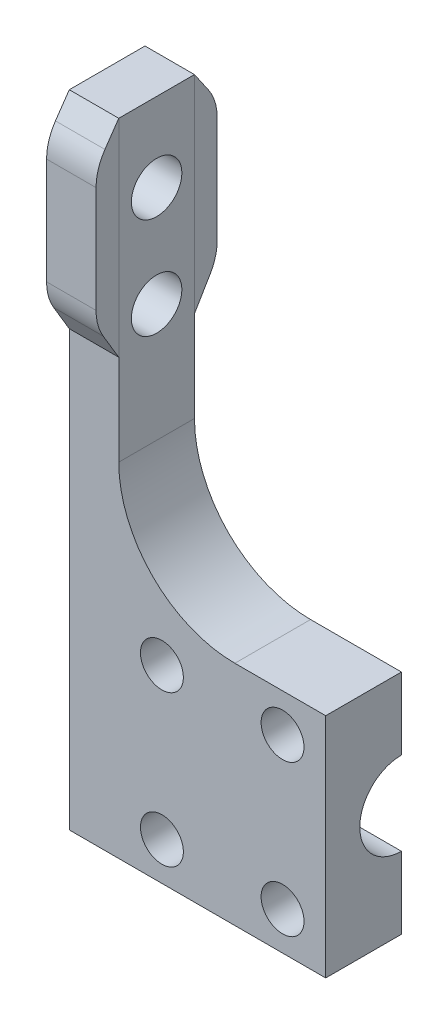
from build123d import *

# Parameters (mm, degrees)
SKETCH4_W             = 41
SKETCH4_H             = 45
SKETCH4_R             = 4.25
BOSS_EXTRUDE1_DEPTH   = 15
SKETCH6_W             = 9.8
SKETCH6_H             = 127
BOSS_EXTRUDE2_DEPTH   = 15
SKETCH7_R             = 5
BOSS_EXTRUDE3_DEPTH   = 9.8
BOSS_EXTRUDE3_2_DEPTH = 9.8
BOSS_EXTRUDE3_3_DEPTH = 9.8
BOSS_EXTRUDE3_4_DEPTH = 9.8
SKETCH8_R             = 5
CUT_EXTRUDE2_DEPTH    = 15
SKETCH5_R             = 8.25
CUT_EXTRUDE1_DEPTH    = 65
BOSS_EXTRUDE4_DEPTH   = 15


with BuildPart() as part:
    # Sketch4 → Boss-Extrude1 (new body)
    with BuildSketch(Plane.XY):
        Rectangle(SKETCH4_W, SKETCH4_H)
        with Locations((-11.95, 14.95)):
            Circle(SKETCH4_R, mode=Mode.SUBTRACT)
        with Locations((11.95, 14.95)):
            Circle(SKETCH4_R, mode=Mode.SUBTRACT)
        with Locations((11.95, -14.95)):
            Circle(SKETCH4_R, mode=Mode.SUBTRACT)
        with Locations((-11.95, -14.95)):
            Circle(SKETCH4_R, mode=Mode.SUBTRACT)
    extrude(amount=BOSS_EXTRUDE1_DEPTH)

    # Sketch6 → Boss-Extrude2 (add)
    with BuildSketch(Plane(origin=(0, 0, 0), x_dir=(-1, 0, 0), z_dir=(0, 0, -1))):
        with Locations((25.4, 41)):
            Rectangle(SKETCH6_W, SKETCH6_H)
    extrude(amount=-BOSS_EXTRUDE2_DEPTH)


with BuildPart() as body_2:
    # Sketch7 → Boss-Extrude3 (new body)
    with BuildSketch(Plane(origin=(-20.5, 0, 0), x_dir=(0, 0, -1), z_dir=(1, 0, 0))):
        with Locations((-7.5, 88.874855401)):
            Circle(SKETCH7_R)
    extrude(amount=-BOSS_EXTRUDE3_DEPTH)


with BuildPart() as body_3:
    # Sketch7 → Boss-Extrude3 2 (new body)
    with BuildSketch(Plane(origin=(-20.5, 0, 0), x_dir=(0, 0, -1), z_dir=(1, 0, 0))):
        with Locations((-7.5, 68.874855401)):
            Circle(SKETCH7_R)
    extrude(amount=-BOSS_EXTRUDE3_2_DEPTH)


with BuildPart() as body_4:
    # Sketch7 → Boss-Extrude3 3 (new body)
    with BuildSketch(Plane(origin=(-20.5, 0, 0), x_dir=(0, 0, -1), z_dir=(1, 0, 0))):
        with BuildLine():
            Line((0, 63.5), (3.083845628, 68.660020599))
            ThreePointArc((3.083845628, 68.660020599), (4.139462026, 71.129116286), (4.5, 73.790088262))
            Line((4.5, 73.790088262), (4.5, 94.851850656))
            ThreePointArc((4.5, 94.851850656), (4.049421785, 97.819769719), (2.738291287, 100.520232848))
            Line((2.738291287, 100.520232848), (0, 104.5))
            Line((0, 104.5), (0, 63.5))
        make_face()
    extrude(amount=-BOSS_EXTRUDE3_3_DEPTH)


with BuildPart() as body_5:
    # Sketch7 → Boss-Extrude3 4 (new body)
    with BuildSketch(Plane(origin=(-20.5, 0, 0), x_dir=(0, 0, -1), z_dir=(1, 0, 0))):
        with BuildLine():
            Line((-15, 63.5), (-18.083845628, 68.660020599))
            ThreePointArc((-18.083845628, 68.660020599), (-19.139462026, 71.129116286), (-19.5, 73.790088262))
            Line((-19.5, 73.790088262), (-19.5, 94.851850656))
            ThreePointArc((-19.5, 94.851850656), (-19.049421785, 97.819769719), (-17.738291287, 100.520232848))
            Line((-17.738291287, 100.520232848), (-15, 104.5))
            Line((-15, 104.5), (-15, 63.5))
        make_face()
    extrude(amount=-BOSS_EXTRUDE3_4_DEPTH)


with BuildPart() as cut_extrude2_tool:
    # Sketch8 → Cut-Extrude2 (new body)
    with BuildSketch(Plane(origin=(-20.5, 0, 0), x_dir=(0, 0, -1), z_dir=(1, 0, 0))):
        with Locations((-7.5, 68.874855401)):
            Circle(SKETCH8_R)
        with Locations((-7.5, 88.874855401)):
            Circle(SKETCH8_R)
    extrude(amount=-CUT_EXTRUDE2_DEPTH)


with BuildPart() as part_1:
    add(part.part)

    # Cut-Extrude2: cut by cut_extrude2_tool
    add(cut_extrude2_tool.part, mode=Mode.SUBTRACT)

    # Sketch5 → Cut-Extrude1 (cut)
    with BuildSketch(Plane(origin=(20.5, 0, 0), x_dir=(0, 0, -1), z_dir=(1, 0, 0))):
        Circle(SKETCH5_R)
    extrude(amount=-CUT_EXTRUDE1_DEPTH, mode=Mode.SUBTRACT)

    # Sketch9 → Boss-Extrude4 (add)
    with BuildSketch(Plane(origin=(0, 0, 0), x_dir=(-1, 0, 0), z_dir=(0, 0, -1))):
        with BuildLine():
            Line((-2.5, 22.5), (20.5, 22.5))
            Line((20.5, 22.5), (20.5, 45.5))
            ThreePointArc((20.5, 45.5), (13.763455967, 29.236544033), (-2.5, 22.5))
        make_face()
    extrude(amount=-BOSS_EXTRUDE4_DEPTH)


with BuildPart() as body_2_1:
    add(body_2.part)

    # Cut-Extrude2: cut by cut_extrude2_tool
    add(cut_extrude2_tool.part, mode=Mode.SUBTRACT)


with BuildPart() as body_3_1:
    add(body_3.part)

    # Cut-Extrude2: cut by cut_extrude2_tool
    add(cut_extrude2_tool.part, mode=Mode.SUBTRACT)


solid = Compound([body_4.part, body_5.part, part_1.part])
